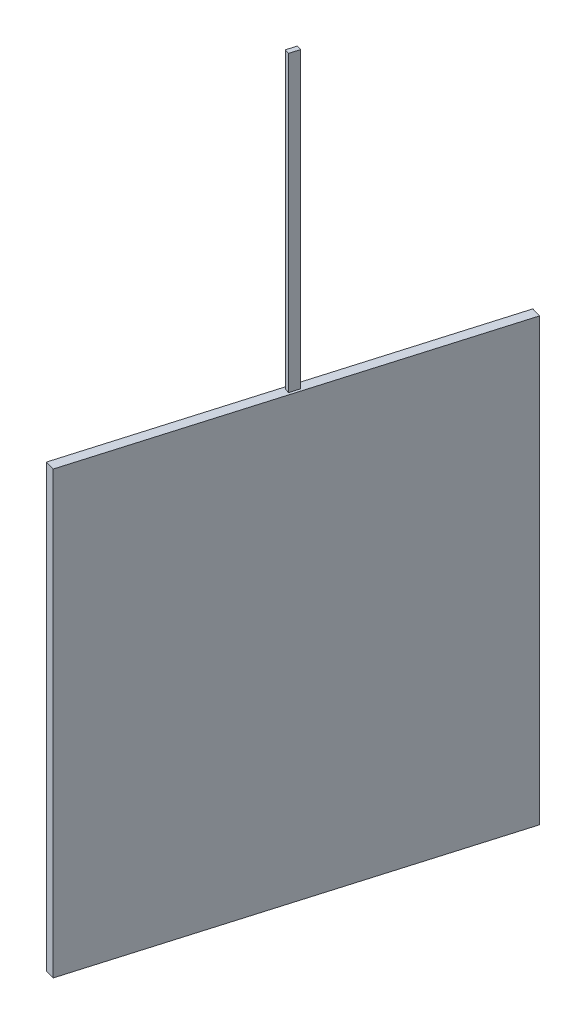
from build123d import *

# Parameters (mm, degrees)
BOSS_EXTRUDE1_DEPTH = 114.3
BOSS_EXTRUDE2_DEPTH = 76.2


with BuildPart() as part:
    # Sketch1 → Boss-Extrude1 (new body)
    with BuildSketch(Plane(origin=(0, 0, 0), x_dir=(1, 0, 0), z_dir=(0, 1, 0))):
        Polygon((-1.218394187, 0.358351231), (1.218394187, -0.358351231), (-27.449704331, -97.829886191), (-29.886492705, -97.113183728), align=None)
    extrude(amount=-BOSS_EXTRUDE1_DEPTH)

    # Sketch2 → Boss-Extrude2 (add)
    with BuildSketch(Plane(origin=(0, 0, 0), x_dir=(1, 0, 0), z_dir=(0, 1, 0))):
        Polygon((-14.584895121, -47.338197677), (-15.301597584, -49.774986051), (-14.083203397, -50.133337283), (-13.366500934, -47.696548909), align=None)
    extrude(amount=BOSS_EXTRUDE2_DEPTH)


solid = part.part
